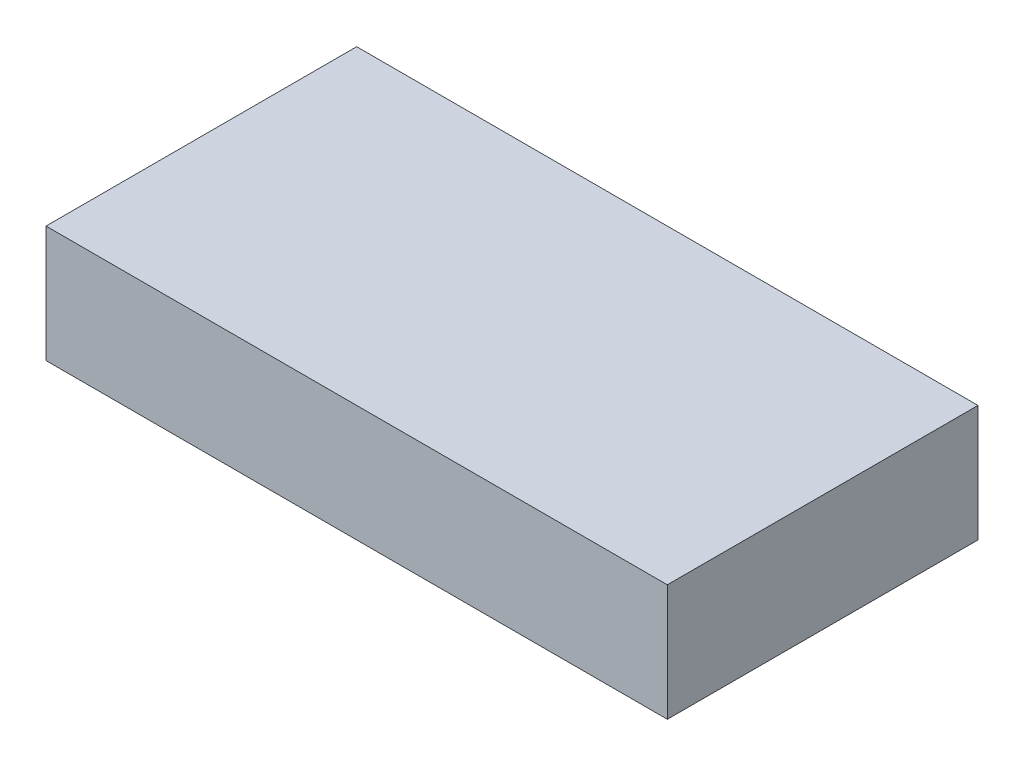
from build123d import *

# Parameters (mm, degrees)
SKETCH7_W      = 101.6
SKETCH7_H      = 50.8
EXTRUDE6_DEPTH = 19.05


with BuildPart() as part:
    # Sketch7 → Extrude6 (new body)
    with BuildSketch(Plane(origin=(0, 0, 0), x_dir=(1, 0, 0), z_dir=(0, 1, 0))):
        with Locations((50.8, 25.4)):
            Rectangle(SKETCH7_W, SKETCH7_H)
    extrude(amount=-EXTRUDE6_DEPTH)


solid = part.part
